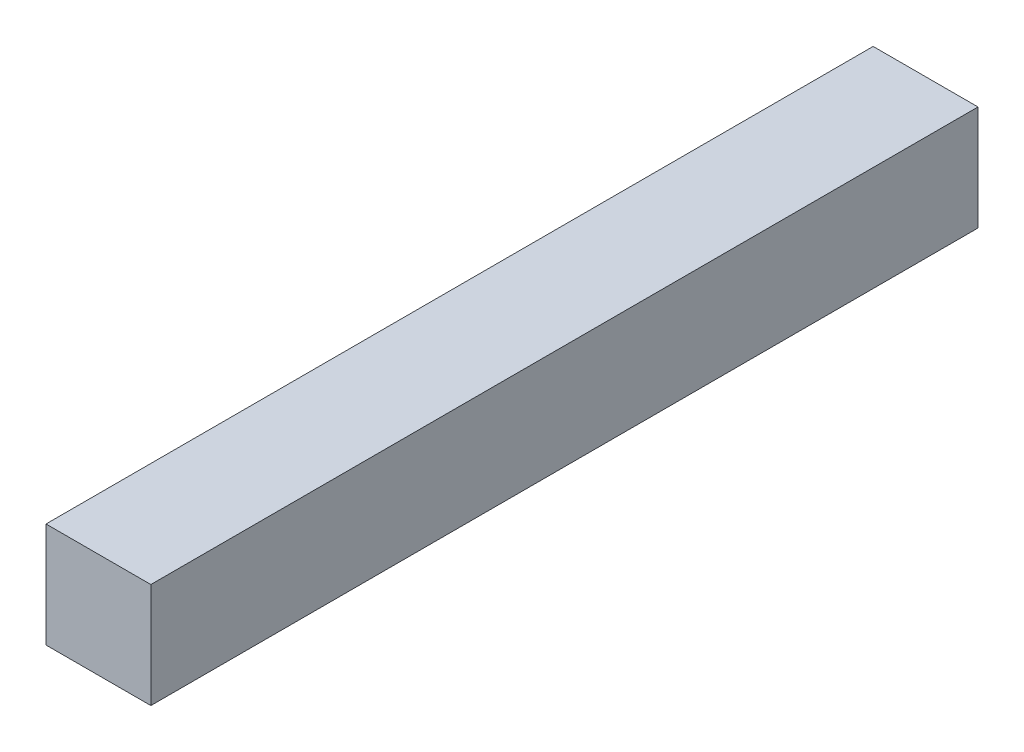
from build123d import *

# Parameters (mm, degrees)
SKETCH1_W           = 18
SKETCH1_H           = 18
BOSS_EXTRUDE1_DEPTH = 142


with BuildPart() as part:
    # Sketch1 → Boss-Extrude1 (new body)
    with BuildSketch(Plane.XY):
        with Locations((-330, 0)):
            Rectangle(SKETCH1_W, SKETCH1_H)
    extrude(amount=BOSS_EXTRUDE1_DEPTH)


solid = part.part
